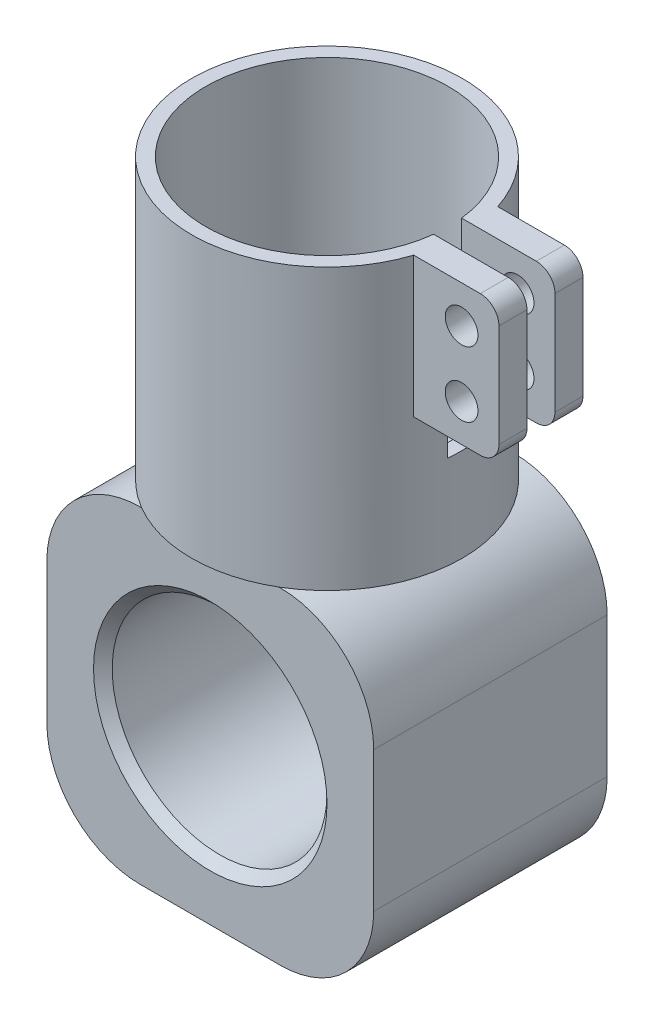
from build123d import *

# Parameters (mm, degrees)
SKETCH2_R           = 11.5
BOSS_EXTRUDE1_DEPTH = 12.5
SKETCH4_R           = 14.5
SKETCH4_R_2         = 13
EXTRUDE_THIN1_DEPTH = 30
SKETCH5_W           = 12.460030261
SKETCH5_H           = 20
CUT_EXTRUDE1_DEPTH  = 1.5
SKETCH8_R           = 1.75
BOSS_EXTRUDE2_DEPTH = 3
CHAMFER1_SIZE       = 1


with BuildPart() as part:
    # Sketch2 → Boss-Extrude1 (new, symmetric)
    with BuildSketch(Plane.XY):
        with BuildLine():
            Line((-7.5, 17.5), (7.5, 17.5))
            ThreePointArc((7.5, 17.5), (14.571067812, 14.571067812), (17.5, 7.5))
            Line((17.5, 7.5), (17.5, -7.5))
            ThreePointArc((17.5, -7.5), (14.571067812, -14.571067812), (7.5, -17.5))
            Line((7.5, -17.5), (-7.5, -17.5))
            ThreePointArc((-7.5, -17.5), (-14.571067812, -14.571067812), (-17.5, -7.5))
            Line((-17.5, -7.5), (-17.5, 7.5))
            ThreePointArc((-17.5, 7.5), (-14.571067812, 14.571067812), (-7.5, 17.5))
        make_face()
        Circle(SKETCH2_R, mode=Mode.SUBTRACT)
    extrude(amount=BOSS_EXTRUDE1_DEPTH, both=True)

    # Sketch4 → Extrude-Thin1 (add)
    with BuildSketch(Plane(origin=(0, 17.5, 0), x_dir=(1, 0, 0), z_dir=(0, 1, 0))):
        Circle(SKETCH4_R)
        Circle(SKETCH4_R_2, mode=Mode.SUBTRACT)
    extrude(amount=EXTRUDE_THIN1_DEPTH)

    # Sketch5 → Cut-Extrude1 (cut, symmetric)
    with BuildSketch(Plane.XY):
        with Locations((15.450437523, 37.5)):
            Rectangle(SKETCH5_W, SKETCH5_H)
    extrude(amount=CUT_EXTRUDE1_DEPTH, both=True, mode=Mode.SUBTRACT)

    # Sketch8 → Boss-Extrude2 (add)
    with BuildSketch(Plane(origin=(0, 0, 1.5), x_dir=(-1, 0, 0), z_dir=(0, 0, -1))):
        with BuildLine():
            Line((-12.91317157, 47.5), (-20.91317157, 47.5))
            ThreePointArc((-20.91317157, 47.5), (-22.327385133, 46.914213562), (-22.91317157, 45.5))
            Line((-22.91317157, 45.5), (-22.91317157, 34.5))
            ThreePointArc((-22.91317157, 34.5), (-22.327385133, 33.085786438), (-20.91317157, 32.5))
            Line((-20.91317157, 32.5), (-12.91317157, 32.5))
            Line((-12.91317157, 32.5), (-12.91317157, 47.5))
        make_face()
        with Locations((-18.91317157, 43.5)):
            Circle(SKETCH8_R, mode=Mode.SUBTRACT)
        with Locations((-18.91317157, 36.5)):
            Circle(SKETCH8_R, mode=Mode.SUBTRACT)
    boss_extrude2 = extrude(amount=-BOSS_EXTRUDE2_DEPTH)

    # Mirror1: Boss-Extrude2 across plane
    add(boss_extrude2.mirror(Plane.XY))

    # Chamfer1
    chamfer1_edges = [part.edges().sort_by_distance(p)[0] for p in [
        (-11.5, 0, -12.5),
        (-11.5, 0, 12.5),
    ]]
    chamfer(chamfer1_edges, length=CHAMFER1_SIZE)


solid = part.part
